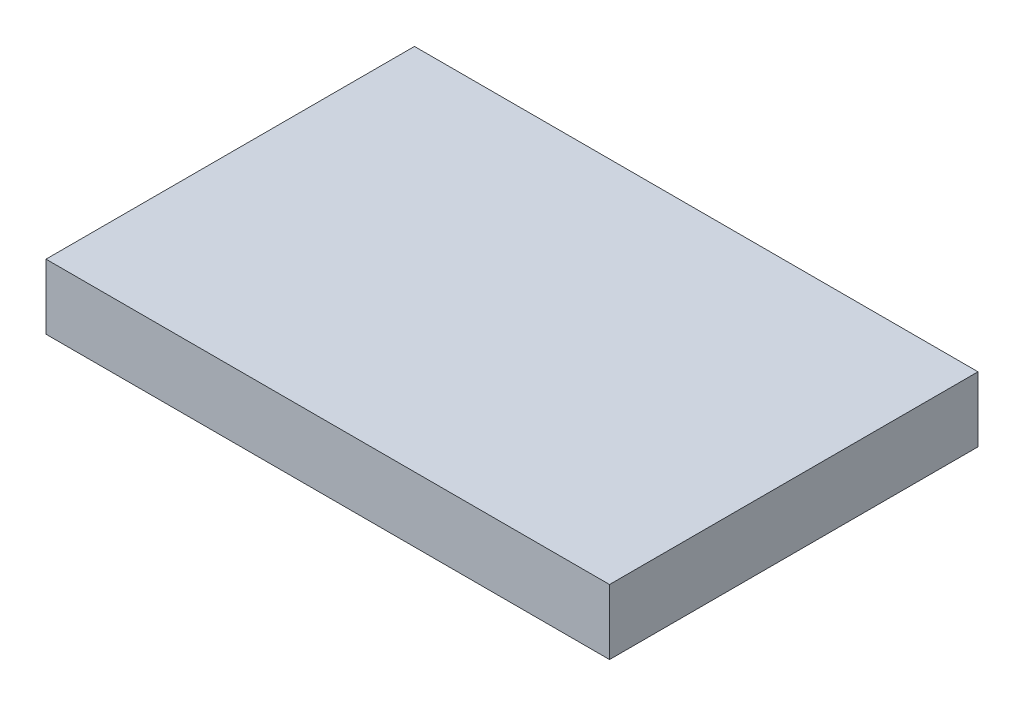
from build123d import *

# Parameters (mm, degrees)
SKETCH1_W           = 82.55
SKETCH1_H           = 53.975
BOSS_EXTRUDE1_DEPTH = 9.525


with BuildPart() as part:
    # Sketch1 → Boss-Extrude1 (new body)
    with BuildSketch(Plane(origin=(0, 0, 0), x_dir=(1, 0, 0), z_dir=(0, 1, 0))):
        with Locations((7.911041667, -5.146145833)):
            Rectangle(SKETCH1_W, SKETCH1_H)
    extrude(amount=BOSS_EXTRUDE1_DEPTH)


solid = part.part
